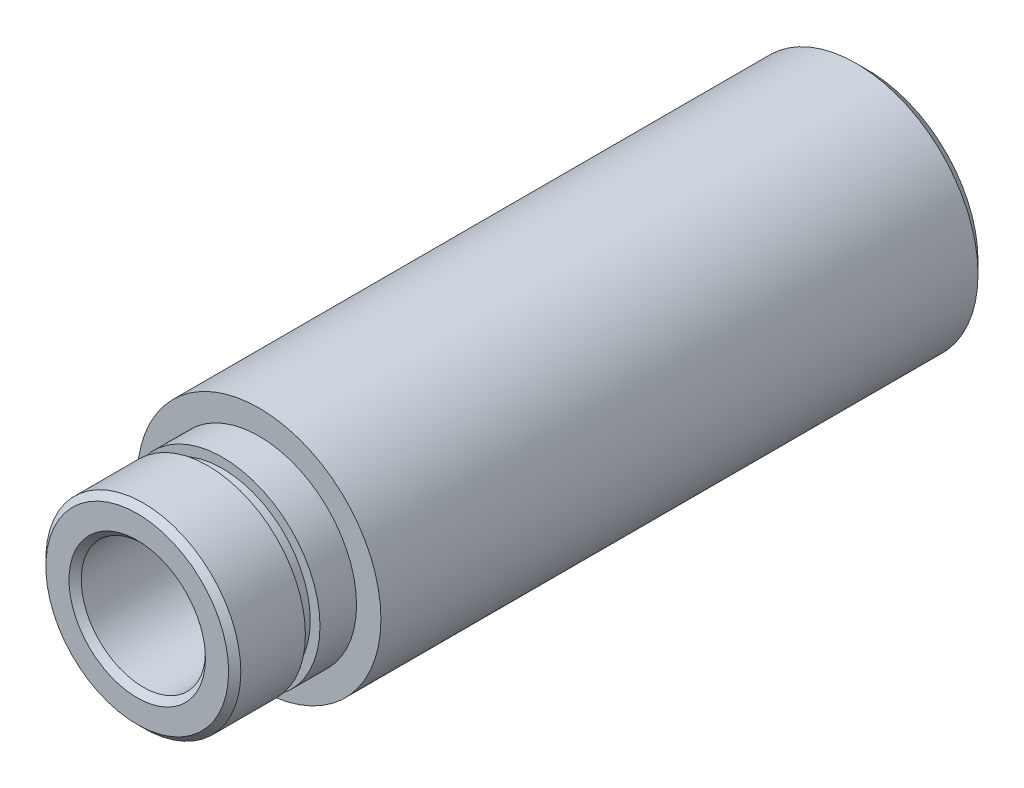
from build123d import *

# Parameters (mm, degrees)
CROQUIS1_R              = 10
CROQUIS1_R_2            = 5.1
SALIENTE_EXTRUIR1_DEPTH = 30
CROQUIS2_OUTSIDE_W      = 35.266
CROQUIS2_OUTSIDE_H      = 35.266
CROQUIS2_OUTSIDE_R      = 8
CORTAR_EXTRUIR1_DEPTH   = 10
CHAFL_N1_SIZE           = 0.5
CROQUIS3_W              = 6
CROQUIS3_H              = 1.2
CHAFL_N2_SIZE           = 1


with BuildPart() as part:
    # Croquis1 → Saliente-Extruir1 (new, symmetric)
    with BuildSketch(Plane.XY):
        Circle(CROQUIS1_R)
        Circle(CROQUIS1_R_2, mode=Mode.SUBTRACT)
    extrude(amount=SALIENTE_EXTRUIR1_DEPTH, both=True)

    # Croquis2 outside → Cortar-Extruir1 (cut)
    with BuildSketch(Plane.XY.offset(30)):
        Rectangle(CROQUIS2_OUTSIDE_W, CROQUIS2_OUTSIDE_H)
        Circle(CROQUIS2_OUTSIDE_R, mode=Mode.SUBTRACT)
    extrude(amount=-CORTAR_EXTRUIR1_DEPTH, mode=Mode.SUBTRACT)

    # Chaflán1
    chafl_n1_edges = [part.edges().sort_by_distance(p)[0] for p in [
        (-8, 0, 30),
        (-5.1, 0, -30),
        (-5.1, 0, 30),
    ]]
    chamfer(chafl_n1_edges, length=CHAFL_N1_SIZE)

    # Croquis3 → Cortar-Revolución1 (revolve, cut)
    with BuildSketch(Plane(origin=(0, 0, 0), x_dir=(1, 0, 0), z_dir=(0, 1, 0))):
        with Locations((10.2, -23.6)):
            Rectangle(CROQUIS3_W, CROQUIS3_H)
    revolve(axis=Axis((0, 0, 0), (0, 0, 1)), mode=Mode.SUBTRACT)

    # Chaflán2
    chafl_n2_edges = [part.edges().sort_by_distance(p)[0] for p in [
        (-10, 0, -30),
    ]]
    chamfer(chafl_n2_edges, length=CHAFL_N2_SIZE)


solid = part.part
